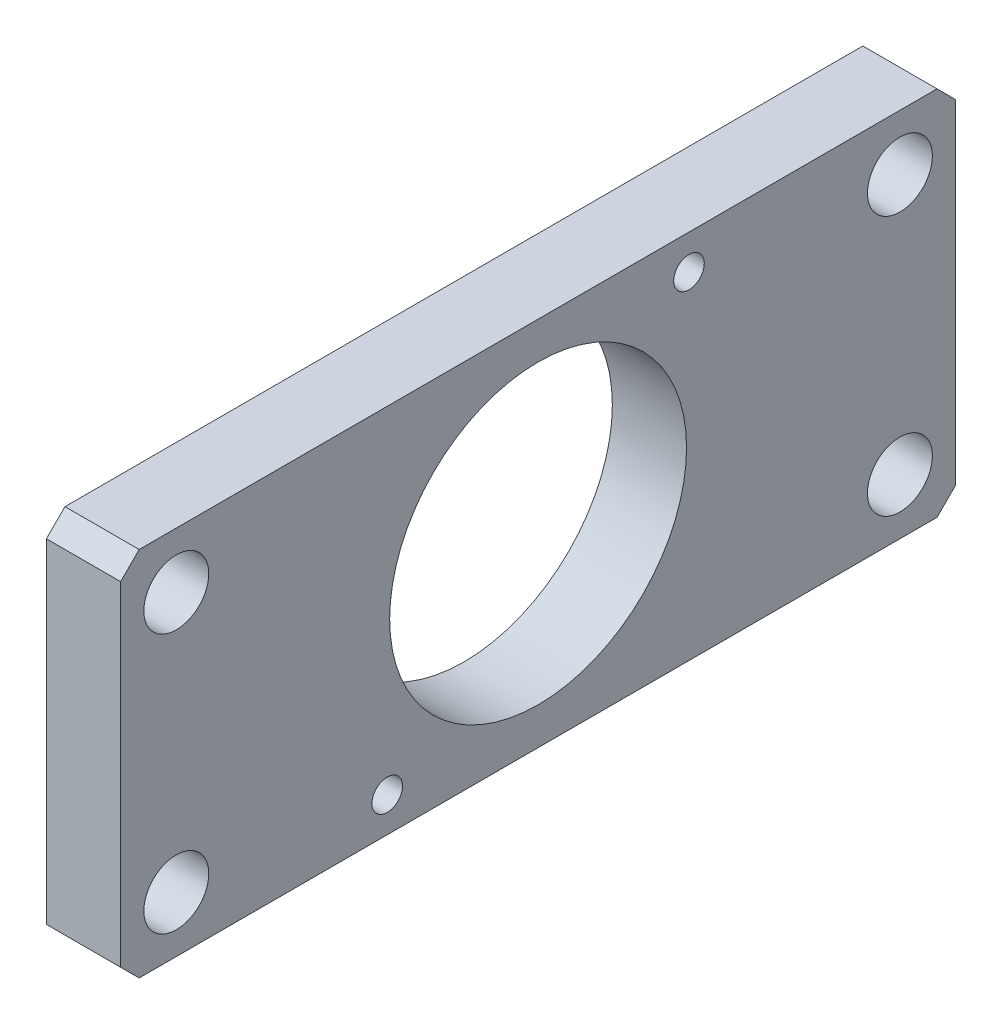
from build123d import *

# Parameters (mm, degrees)
SKETCH1_W                    = 90
SKETCH1_H                    = 40
BOSS_EXTRUDE1_DEPTH          = 8
SKETCH2_R                    = 16
CUT_EXTRUDE1_DEPTH           = 61.737138556
F_7_0_7_DIAMETER_HOLE1_D     = 7
F_7_0_7_DIAMETER_HOLE1_DEPTH = 60
F_7_0_7_DIAMETER_HOLE1_TIP   = 2.103012167
M4X0_7_TAPPED_HOLE1_D        = 3.3
CHAMFER1_SIZE                = 2


with BuildPart() as part:
    # Sketch1 → Boss-Extrude1 (new body)
    with BuildSketch(Plane(origin=(0, 0, 0), x_dir=(0, 0, -1), z_dir=(1, 0, 0))):
        with Locations((0, 20)):
            Rectangle(SKETCH1_W, SKETCH1_H)
    extrude(amount=BOSS_EXTRUDE1_DEPTH)

    # Sketch2 → Cut-Extrude1 (cut, through all)
    with BuildSketch(Plane(origin=(8, 0, 0), x_dir=(0, 0, -1), z_dir=(1, 0, 0))):
        with Locations((0, 20)):
            Circle(SKETCH2_R)
    extrude(amount=-CUT_EXTRUDE1_DEPTH, mode=Mode.SUBTRACT)

    # Ø7.0 (7) Diameter Hole1
    with Locations(Plane(origin=(8, 0, 0), x_dir=(0, 0, -1), z_dir=(1, 0, 0))):
        with Locations((-39, 6), (39, 6), (39, 34), (-39, 34)):
            Hole(F_7_0_7_DIAMETER_HOLE1_D / 2, depth=F_7_0_7_DIAMETER_HOLE1_DEPTH)
            with Locations((0, 0, -(F_7_0_7_DIAMETER_HOLE1_DEPTH + F_7_0_7_DIAMETER_HOLE1_TIP / 2))):  # 118° drill point
                Cone(0, F_7_0_7_DIAMETER_HOLE1_D / 2, F_7_0_7_DIAMETER_HOLE1_TIP, mode=Mode.SUBTRACT)

    # M4x0.7 Tapped Hole1 (through all)
    with Locations(Plane(origin=(8, 0, 0), x_dir=(0, 0, -1), z_dir=(1, 0, 0))):
        with Locations((16.263455967, 36.263455967), (-16.263455967, 3.736544033)):
            Hole(M4X0_7_TAPPED_HOLE1_D / 2)

    # Chamfer1
    chamfer1_edges = [part.edges().sort_by_distance(p)[0] for p in [
        (4, 0, -45),
        (4, 0, 45),
        (4, 40, 45),
        (4, 40, -45),
    ]]
    chamfer(chamfer1_edges, length=CHAMFER1_SIZE)


solid = part.part
